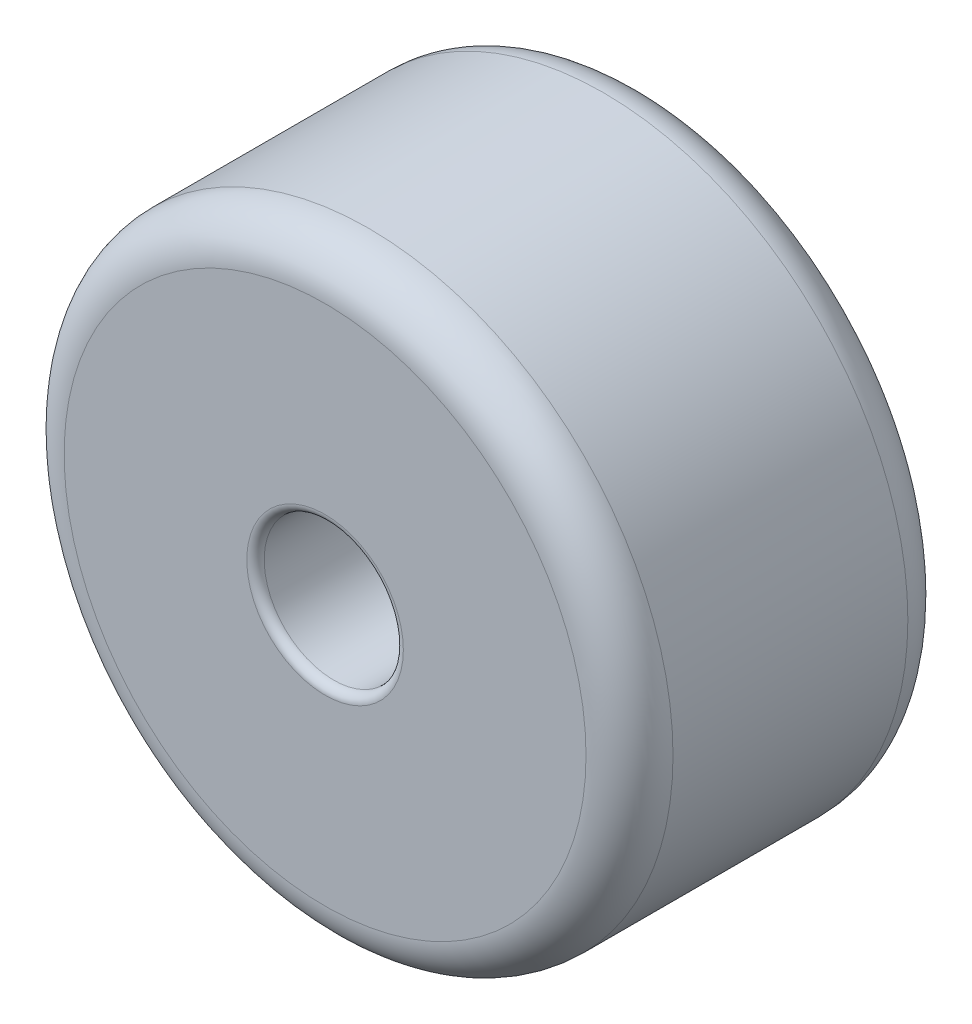
from build123d import *

# Parameters (mm, degrees)
SKETCH_1_R      = 17.5
SKETCH_1_R_2    = 4
EXTRUDE_1_DEPTH = 9.25
FILLET_1_R      = 2.5
FILLET_2_R      = 0.5


with BuildPart() as part:
    # 草图1 → 凸台-拉伸1 (new, symmetric)
    with BuildSketch(Plane.XY):
        Circle(SKETCH_1_R)
        Circle(SKETCH_1_R_2, mode=Mode.SUBTRACT)
    extrude(amount=EXTRUDE_1_DEPTH, both=True)

    # 圆角1
    fillet_1_edges = [part.edges().sort_by_distance(p)[0] for p in [
        (-17.5, 0, -9.25),
        (-17.5, 0, 9.25),
    ]]
    fillet(fillet_1_edges, radius=FILLET_1_R)

    # 圆角2
    fillet_2_edges = [part.edges().sort_by_distance(p)[0] for p in [
        (-4, 0, -9.25),
        (-4, 0, 9.25),
    ]]
    fillet(fillet_2_edges, radius=FILLET_2_R)


solid = part.part
